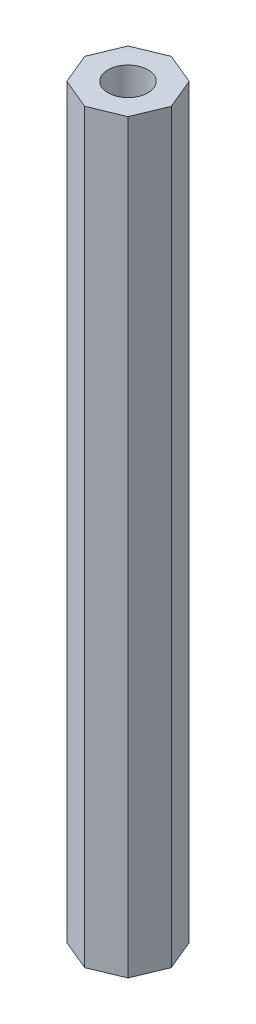
from build123d import *

# Parameters (mm, degrees)
SKETCH1_R           = 0.75
BOSS_EXTRUDE1_DEPTH = 28


with BuildPart() as part:
    # Sketch1 → Boss-Extrude1 (new body)
    with BuildSketch(Plane(origin=(0, 0, 0), x_dir=(1, 0, 0), z_dir=(0, 1, 0))):
        Polygon((1.6235883, 0), (1.148050297, 1.148050297), (0, 1.6235883), (-1.148050297, 1.148050297), (-1.6235883, 0), (-1.148050297, -1.148050297), (0, -1.6235883), (1.148050297, -1.148050297), align=None)
        with Locations(Location((0, 0, 0), (0, 0, 270))):
            Circle(SKETCH1_R, mode=Mode.SUBTRACT)
    extrude(amount=BOSS_EXTRUDE1_DEPTH)


solid = part.part
